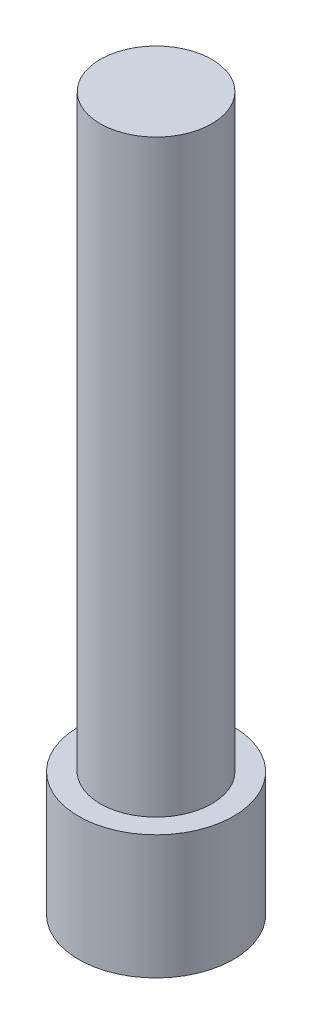
from build123d import *

# Parameters (mm, degrees)
SKETCH1_R           = 0.9
BOSS_EXTRUDE1_DEPTH = 9.5
SKETCH2_R           = 1.25
BOSS_EXTRUDE2_DEPTH = 2


with BuildPart() as part:
    # Sketch1 → Boss-Extrude1 (new body)
    with BuildSketch(Plane(origin=(0, 0, 0), x_dir=(1, 0, 0), z_dir=(0, 1, 0))):
        with Locations(Location((0, 0, 0), (0, 0, 270))):
            Circle(SKETCH1_R)
    extrude(amount=BOSS_EXTRUDE1_DEPTH)

    # Sketch2 → Boss-Extrude2 (add)
    with BuildSketch(Plane.XZ):
        with Locations(Location((0, 0, 0), (0, 0, 270))):
            Circle(SKETCH2_R)
    extrude(amount=BOSS_EXTRUDE2_DEPTH)


solid = part.part
